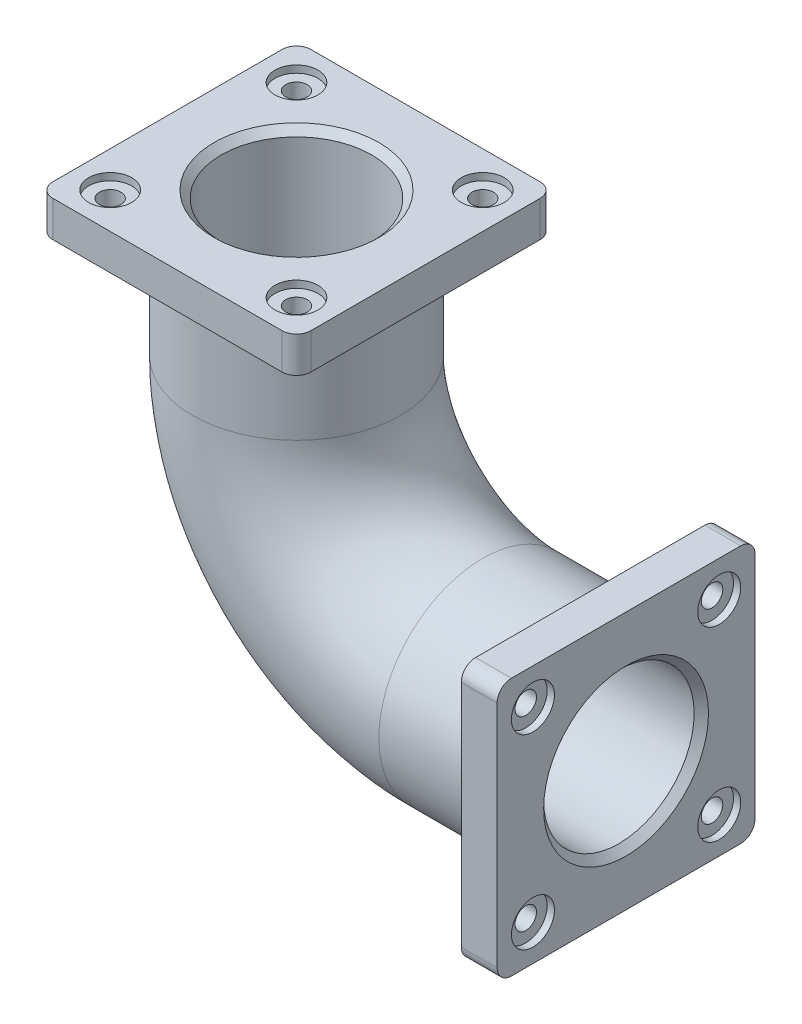
from build123d import *

# Parameters (mm, degrees)
SWEEP_THIN1_PROFILE_R   = 145
SWEEP_THIN1_PROFILE_R_2 = 105
BOSS_EXTRUDE2_DEPTH     = 50
SKETCH26_R              = 30
SKETCH26_R_2            = 15
CUT_EXTRUDE2_DEPTH      = 10
SKETCH26_3_R            = 15
CUT_EXTRUDE3_DEPTH      = 50
BOSS_EXTRUDE3_DEPTH     = 50
SKETCH28_R              = 30
SKETCH28_R_2            = 15
CUT_EXTRUDE4_DEPTH      = 10
SKETCH28_3_R            = 15
CUT_EXTRUDE5_DEPTH      = 50
CHAMFER1_SIZE           = 10
SKETCH29_R              = 105
CUT_EXTRUDE7_DEPTH      = 75
CUT_EXTRUDE8_START      = -75
SKETCH30_R              = 105
CUT_EXTRUDE8_DEPTH      = 75
CHAMFER2_SIZE           = 10
CHAMFER3_SIZE           = 10


with BuildPart() as part:
    # Sweep-Thin1: sweep along a path in Sketch1
    with BuildLine(Plane.XY) as sweep_thin1_path:
        Line((0, 410), (0, 260))
        ThreePointArc((0, 260), (76.152236891, 76.152236891), (260, 0))
        Line((260, 0), (410, 0))
    # Sweep-Thin1 profile (on start of the path) → Sweep-Thin1 (sweep)
    with BuildSketch(Plane(origin=(0, 410, 0), x_dir=(0, 0, -1), z_dir=(0, -1, 0))):
        Circle(SWEEP_THIN1_PROFILE_R)
        Circle(SWEEP_THIN1_PROFILE_R_2, mode=Mode.SUBTRACT)
    sweep(path=sweep_thin1_path.line)

    # Sketch24 → Boss-Extrude2 (add)
    with BuildSketch(Plane(origin=(410, 0, 0), x_dir=(0, 0, -1), z_dir=(1, 0, 0))):
        with BuildLine():
            Line((-160, 180), (160, 180))
            ThreePointArc((160, 180), (174.142135624, 174.142135624), (180, 160))
            Line((180, 160), (180, -160))
            ThreePointArc((180, -160), (174.142135624, -174.142135624), (160, -180))
            Line((160, -180), (-160, -180))
            ThreePointArc((-160, -180), (-174.142135624, -174.142135624), (-180, -160))
            Line((-180, -160), (-180, 160))
            ThreePointArc((-180, 160), (-174.142135624, 174.142135624), (-160, 180))
        make_face()
    extrude(amount=BOSS_EXTRUDE2_DEPTH)

    # Sketch26 → Cut-Extrude2 (cut)
    # profile 1 of 4: a face of its own
    with BuildSketch(Plane(origin=(460, 0, 0), x_dir=(0, 0, -1), z_dir=(1, 0, 0))):
        with Locations((-130, 130)):
            Circle(SKETCH26_R)
        with Locations((-130, 130)):
            Circle(SKETCH26_R_2, mode=Mode.SUBTRACT)
    # profile 2 of 4: a face of its own
    with BuildSketch(Plane(origin=(460, 0, 0), x_dir=(0, 0, -1), z_dir=(1, 0, 0))):
        with Locations((-130, -130)):
            Circle(SKETCH26_R)
        with Locations((-130, -130)):
            Circle(SKETCH26_R_2, mode=Mode.SUBTRACT)
    # profile 3 of 4: a face of its own
    with BuildSketch(Plane(origin=(460, 0, 0), x_dir=(0, 0, -1), z_dir=(1, 0, 0))):
        with Locations((130, 130)):
            Circle(SKETCH26_R)
        with Locations((130, 130)):
            Circle(SKETCH26_R_2, mode=Mode.SUBTRACT)
    # profile 4 of 4: a face of its own
    with BuildSketch(Plane(origin=(460, 0, 0), x_dir=(0, 0, -1), z_dir=(1, 0, 0))):
        with Locations((130, -130)):
            Circle(SKETCH26_R)
        with Locations((130, -130)):
            Circle(SKETCH26_R_2, mode=Mode.SUBTRACT)
    extrude(amount=-CUT_EXTRUDE2_DEPTH, mode=Mode.SUBTRACT)

    # Sketch26<3> → Cut-Extrude3 (cut)
    with BuildSketch(Plane(origin=(460, 0, 0), x_dir=(0, 0, -1), z_dir=(1, 0, 0))):
        with Locations((-130, 130)):
            Circle(SKETCH26_3_R)
        with Locations((-130, -130)):
            Circle(SKETCH26_3_R)
        with Locations((130, -130)):
            Circle(SKETCH26_3_R)
        with Locations((130, 130)):
            Circle(SKETCH26_3_R)
    extrude(amount=-CUT_EXTRUDE3_DEPTH, mode=Mode.SUBTRACT)

    # Sketch27 → Boss-Extrude3 (add)
    with BuildSketch(Plane(origin=(0, 410, 0), x_dir=(1, 0, 0), z_dir=(0, 1, 0))):
        with BuildLine():
            Line((-160, 180), (160, 180))
            ThreePointArc((160, 180), (174.142135624, 174.142135624), (180, 160))
            Line((180, 160), (180, -160))
            ThreePointArc((180, -160), (174.142135624, -174.142135624), (160, -180))
            Line((160, -180), (-160, -180))
            ThreePointArc((-160, -180), (-174.142135624, -174.142135624), (-180, -160))
            Line((-180, -160), (-180, 160))
            ThreePointArc((-180, 160), (-174.142135624, 174.142135624), (-160, 180))
        make_face()
    extrude(amount=BOSS_EXTRUDE3_DEPTH)

    # Sketch28 → Cut-Extrude4 (cut)
    # profile 1 of 4: a face of its own
    with BuildSketch(Plane(origin=(0, 460, 0), x_dir=(1, 0, 0), z_dir=(0, 1, 0))):
        with Locations(Location((-130, 130, 0), (0, 0, 270))):
            Circle(SKETCH28_R)
        with Locations(Location((-130, 130, 0), (0, 0, 270))):
            Circle(SKETCH28_R_2, mode=Mode.SUBTRACT)
    # profile 2 of 4: a face of its own
    with BuildSketch(Plane(origin=(0, 460, 0), x_dir=(1, 0, 0), z_dir=(0, 1, 0))):
        with Locations(Location((-130, -130, 0), (0, 0, 270))):
            Circle(SKETCH28_R)
        with Locations(Location((-130, -130, 0), (0, 0, 270))):
            Circle(SKETCH28_R_2, mode=Mode.SUBTRACT)
    # profile 3 of 4: a face of its own
    with BuildSketch(Plane(origin=(0, 460, 0), x_dir=(1, 0, 0), z_dir=(0, 1, 0))):
        with Locations(Location((130, -130, 0), (0, 0, 270))):
            Circle(SKETCH28_R)
        with Locations(Location((130, -130, 0), (0, 0, 270))):
            Circle(SKETCH28_R_2, mode=Mode.SUBTRACT)
    # profile 4 of 4: a face of its own
    with BuildSketch(Plane(origin=(0, 460, 0), x_dir=(1, 0, 0), z_dir=(0, 1, 0))):
        with Locations(Location((130, 130, 0), (0, 0, 270))):
            Circle(SKETCH28_R)
        with Locations(Location((130, 130, 0), (0, 0, 270))):
            Circle(SKETCH28_R_2, mode=Mode.SUBTRACT)
    extrude(amount=-CUT_EXTRUDE4_DEPTH, mode=Mode.SUBTRACT)

    # Sketch28<3> → Cut-Extrude5 (cut)
    with BuildSketch(Plane(origin=(0, 460, 0), x_dir=(1, 0, 0), z_dir=(0, 1, 0))):
        with Locations(Location((-130, 130, 0), (0, 0, 270))):
            Circle(SKETCH28_3_R)
        with Locations(Location((-130, -130, 0), (0, 0, 270))):
            Circle(SKETCH28_3_R)
        with Locations(Location((130, 130, 0), (0, 0, 270))):
            Circle(SKETCH28_3_R)
        with Locations(Location((130, -130, 0), (0, 0, 270))):
            Circle(SKETCH28_3_R)
    extrude(amount=-CUT_EXTRUDE5_DEPTH, mode=Mode.SUBTRACT)

    # Chamfer1
    chamfer1_edges = [part.edges().sort_by_distance(p)[0] for p in [
        (410, 0, 105),
    ]]
    chamfer(chamfer1_edges, length=CHAMFER1_SIZE)

    # Sketch29 → Cut-Extrude7 (cut)
    with BuildSketch(Plane(origin=(460, 0, 0), x_dir=(0, 0, -1), z_dir=(1, 0, 0))):
        Circle(SKETCH29_R)
    extrude(amount=-CUT_EXTRUDE7_DEPTH, mode=Mode.SUBTRACT)

    # Sketch30 → Cut-Extrude8 (cut)
    with BuildSketch(Plane(origin=(0, 460, 0), x_dir=(1, 0, 0), z_dir=(0, 1, 0)).offset(CUT_EXTRUDE8_START)):
        with Locations(Location((0, 0, 0), (0, 0, 180))):
            Circle(SKETCH30_R)
    extrude(amount=CUT_EXTRUDE8_DEPTH, mode=Mode.SUBTRACT)

    # Chamfer2
    chamfer2_edges = [part.edges().sort_by_distance(p)[0] for p in [
        (105, 460, 0),
    ]]
    chamfer(chamfer2_edges, length=CHAMFER2_SIZE)

    # Chamfer3
    chamfer3_edges = [part.edges().sort_by_distance(p)[0] for p in [
        (460, 0, 105),
    ]]
    chamfer(chamfer3_edges, length=CHAMFER3_SIZE)


solid = part.part
